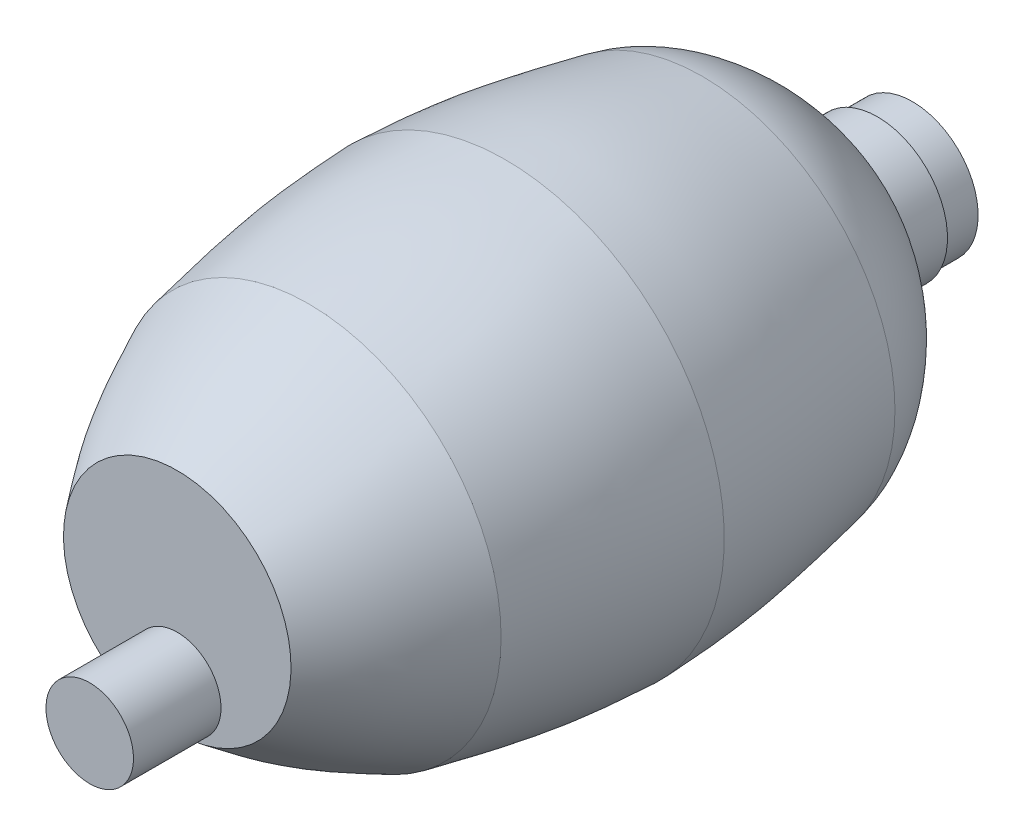
from build123d import *

# Parameters (mm, degrees)
SKETCH4_R            = 12.7
BAG_ATTACHMENT_DEPTH = 25.4


with BuildPart() as part:
    # Sketch1 → body (revolve)
    with BuildSketch(Plane(origin=(0, 0, 0), x_dir=(1, 0, 0), z_dir=(0, 1, 0)), mode=Mode.PRIVATE) as body_sk:
        with BuildLine():
            Line((0, 95.25), (0, -95.25))
            Line((0, -95.25), (33.02, -95.25))
            add(Edge.make_bspline(
                [(55.88, -57.15), (52.333253403, -64.649759535), (45.965562244, -78.114536673), (36.994334659, -89.98935048), (33.02, -95.25)],
                knots=[0, 0, 0, 0, 0.556990989, 1, 1, 1, 1], degree=3))
            add(Edge.make_bspline(
                [(55.88, -57.15), (58.418345497, -44.49907482), (62.211374207, -25.594901819), (63.179693062, -6.361990172), (63.5, 0)],
                knots=[0, 0, 0, 0, 0.669213363, 1, 1, 1, 1], degree=3))
            add(Edge.make_bspline(
                [(55.88, 57.15), (58.418345497, 44.49907482), (62.211374207, 25.594901819), (63.179693062, 6.361990172), (63.5, 0)],
                knots=[0, 0, 0, 0, 0.669213363, 1, 1, 1, 1], degree=3))
            add(Edge.make_bspline(
                [(20.32, 95.25), (27.263983104, 91.241807371), (42.563906598, 82.410414831), (54.075514966, 66.14341921), (55.88, 57.15)],
                knots=[0, 0, 0, 0, 0.453857374, 1, 1, 1, 1], degree=3))
            Line((20.32, 95.25), (20.32, 107.95))
            Line((20.32, 107.95), (19.05, 107.95))
            Line((19.05, 107.95), (19.05, 118.11))
            Line((19.05, 118.11), (0, 118.11))
            Line((0, 118.11), (0, 107.95))
            Line((0, 107.95), (0, 95.25))
        make_face()
    revolve(body_sk.sketch.rotate(Axis((0, 0, -95.25), (0, 0, 1)), 180), axis=Axis((0, 0, -95.25), (0, 0, 1)))

    # Sketch4 → bag_attachment (add)
    with BuildSketch(Plane.XY.offset(95.25)):
        with Locations(Location((0, -20.32, 0), (0, 0, 270))):
            Circle(SKETCH4_R)
    extrude(amount=BAG_ATTACHMENT_DEPTH)


solid = part.part
